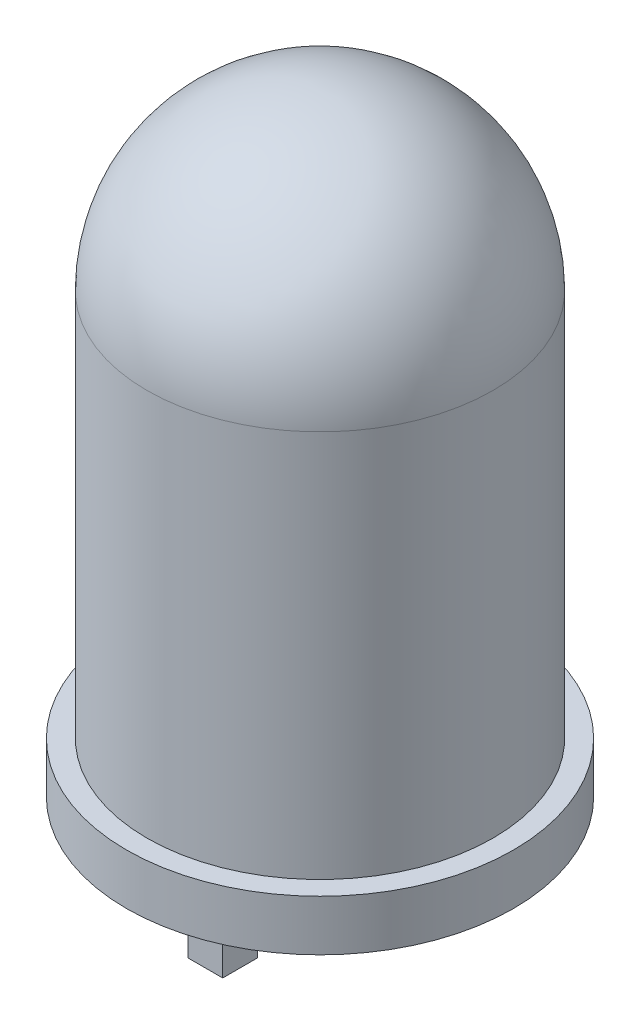
from build123d import *

# Parameters (mm, degrees)
SKETCH2_W               = 0.5
SKETCH2_H               = 0.5
BOSS_EXTRUDE1_DEPTH     = 2
CUT_EXTRUDE1_DEPTH      = 8.611008475
CUT_EXTRUDE1_DEPTH_BACK = 8.611008475
SKETCH3_W               = 3.125046629
SKETCH3_H               = 2.55575519


with BuildPart() as part:
    # Sketch1 → Revolve1 (revolve)
    with BuildSketch(Plane.XY, mode=Mode.PRIVATE) as revolve1_sk:
        with BuildLine():
            Line((0, -4.4), (0, 4.4))
            ThreePointArc((0, 4.4), (1.760695885, 3.670695885), (2.49, 1.91))
            Line((2.49, 1.91), (2.49, -3.669868996))
            Line((2.49, -3.669868996), (2.785, -3.669868996))
            Line((2.785, -3.669868996), (2.785, -4.4))
            Line((2.785, -4.4), (0, -4.4))
        make_face()
    revolve(revolve1_sk.sketch.rotate(Axis((0, -4.4, 0), (0, 1, 0)), 90), axis=Axis((0, -4.4, 0), (0, 1, 0)))

    # Sketch2 → Boss-Extrude1 (add)
    with BuildSketch(Plane.XZ.offset(4.4)):
        with Locations((0, -1.4)):
            Rectangle(SKETCH2_W, SKETCH2_H)
        with Locations((0, 1.4)):
            Rectangle(SKETCH2_W, SKETCH2_H)
    extrude(amount=BOSS_EXTRUDE1_DEPTH)

    # Sketch3 → Cut-Extrude1 (cut, two sides: drawn at the far end of the back side and taken through both)
    with BuildSketch(Plane(origin=(0.25, 0, 0), x_dir=(0, 0, -1), z_dir=(1, 0, 0)).offset(-CUT_EXTRUDE1_DEPTH_BACK)):
        with Locations((-1.351312101, -6.985445416)):
            Rectangle(SKETCH3_W, SKETCH3_H)
    extrude(amount=CUT_EXTRUDE1_DEPTH + CUT_EXTRUDE1_DEPTH_BACK, mode=Mode.SUBTRACT)


solid = part.part
